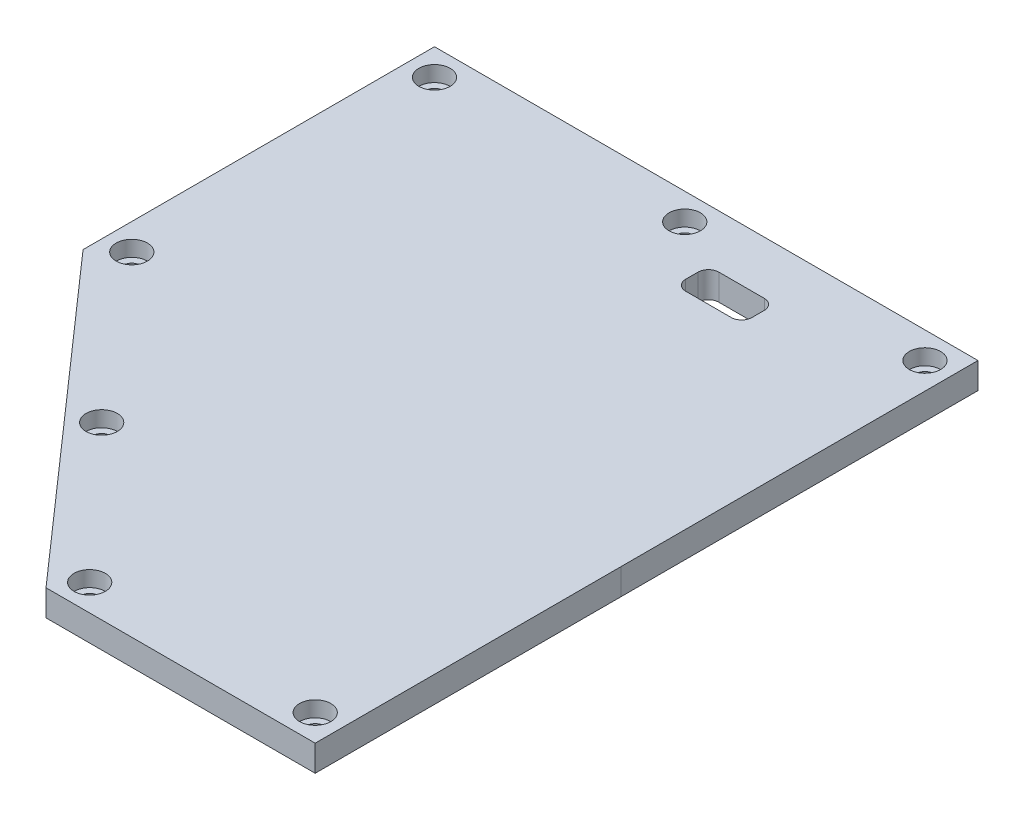
from build123d import *

# Parameters (mm, degrees)
BOSS_EXTRUDE1_DEPTH   = 5
F_4_0MM_DOWEL_HOLE1_D = 3.3
SKETCH4_W             = 12.7
SKETCH4_H             = 6.35
CUT_EXTRUDE1_DEPTH    = 5
FILLET1_R             = 2
SKETCH5_R             = 3
CUT_EXTRUDE2_DEPTH    = 3


with BuildPart() as part:
    # Sketch1 → Boss-Extrude1 (new body)
    with BuildSketch(Plane(origin=(0, 0, 0), x_dir=(1, 0, 0), z_dir=(0, 1, 0))):
        Polygon((0, 0), (104.14, 0), (104.140084457, -68.379681711), (104.140084457, -126.999681711), (52.560084457, -126.999681711), (0, -67.34), align=None)
    extrude(amount=BOSS_EXTRUDE1_DEPTH)

    # Ø4.0mm Dowel Hole1 (through all)
    with Locations(Plane(origin=(5.08, 5, 5.08), x_dir=(0, 0, 1), z_dir=(0, 1, 0))):
        with Locations((0, 0), (0, 47.95), (0, 93.980006274), (116.839681711, 93.980084457), (116.839681711, 50.770084457), (89.156056724, 25.385630403), (58, 0)):
            Hole(F_4_0MM_DOWEL_HOLE1_D / 2)

    # Sketch4 → Cut-Extrude1 (cut)
    with BuildSketch(Plane(origin=(0, 5, 0), x_dir=(1, 0, 0), z_dir=(0, 1, 0))):
        with Locations((69, -13.335)):
            Rectangle(SKETCH4_W, SKETCH4_H)
    extrude(amount=-CUT_EXTRUDE1_DEPTH, mode=Mode.SUBTRACT)

    # Fillet1
    fillet1_edges = [part.edges().sort_by_distance(p)[0] for p in [
        (62.65, 2.5, 10.16),
        (62.65, 2.5, 16.51),
        (75.35, 2.5, 16.51),
        (75.35, 2.5, 10.16),
    ]]
    fillet(fillet1_edges, radius=FILLET1_R)

    # Sketch5 → Cut-Extrude2 (cut)
    with BuildSketch(Plane(origin=(0, 5, 0), x_dir=(1, 0, 0), z_dir=(0, 1, 0))):
        with Locations(Location((55.850084457, -121.919681711, 0), (0, 0, 270))):
            Circle(SKETCH5_R)
        with Locations(Location((99.060084457, -121.919681711, 0), (0, 0, 270))):
            Circle(SKETCH5_R)
        with Locations(Location((30.465630403, -94.236056724, 0), (0, 0, 270))):
            Circle(SKETCH5_R)
        with Locations(Location((5.08, -63.08, 0), (0, 0, 270))):
            Circle(SKETCH5_R)
        with Locations(Location((5.08, -5.08, 0), (0, 0, 270))):
            Circle(SKETCH5_R)
        with Locations(Location((53.03, -5.08, 0), (0, 0, 270))):
            Circle(SKETCH5_R)
        with Locations(Location((99.060006274, -5.08, 0), (0, 0, 270))):
            Circle(SKETCH5_R)
    extrude(amount=-CUT_EXTRUDE2_DEPTH, mode=Mode.SUBTRACT)


solid = part.part
